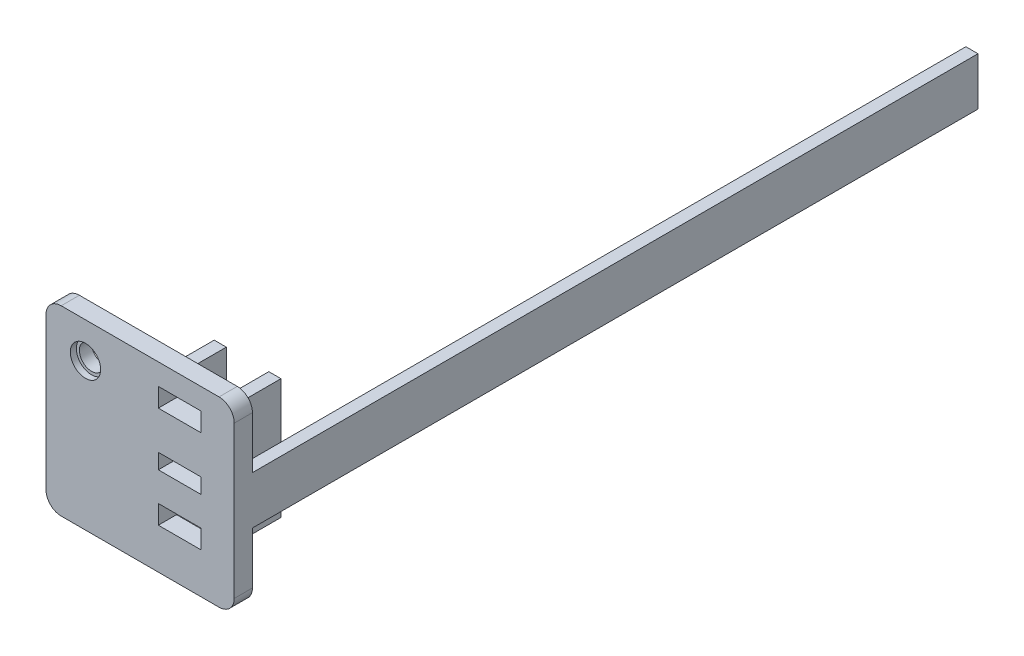
from build123d import *

# Parameters (mm, degrees)
CROQUIS2_W               = 30
CROQUIS2_H               = 31
CROQUIS2_W_2             = 3.1
CROQUIS2_H_2             = 7
CROQUIS2_W_3             = 2.5
CROQUIS2_R               = 2
SALIENTE_EXTRUIR1_DEPTH  = 3
CORTAR_EXTRUIR1_START    = 2
CROQUIS2_4_R             = 2.5
CROQUIS2_4_R_2           = 2
CORTAR_EXTRUIR1_DEPTH    = 1
CROQUIS2_5_W             = 14.15
CROQUIS2_5_H             = 10.7
SALIENTE_EXTRUIR2_DEPTH  = 2
CROQUIS2_7_W             = 7.9
CROQUIS2_7_H             = 2
SALIENTE_EXTRUIR3_DEPTH  = 119.5
CROQUIS2_9_W             = 4.8
CROQUIS2_9_H             = 7
CROQUIS2_9_W_2           = 6.3
SALIENTE_EXTRUIR4_DEPTH  = 0.6
SALIENTE_EXTRUIR5_DEPTH  = 8.2
CROQUIS3_R               = 0.95
SALIENTE_EXTRUIR6_DEPTH  = 0.4
REDONDEO1_R              = 0.25
REDONDEO1_OF_SIMETR_A1_R = 0.25
REDONDEO2_R              = 2.5


with BuildPart() as part:
    # Croquis2 → Saliente-Extruir1 (new body)
    with BuildSketch(Plane(origin=(0, 0, 0), x_dir=(0, 1, 0), z_dir=(0, 0, 1))):
        Rectangle(CROQUIS2_W, CROQUIS2_H)
        with Locations((9.95, -6.5)):
            Rectangle(CROQUIS2_W_2, CROQUIS2_H_2, mode=Mode.SUBTRACT)
        with Locations((0.85, -6.5)):
            Rectangle(CROQUIS2_W_3, CROQUIS2_H_2, mode=Mode.SUBTRACT)
        with Locations((-6.75, -6.5)):
            Rectangle(CROQUIS2_W_2, CROQUIS2_H_2, mode=Mode.SUBTRACT)
        with Locations(Location((9.15, 9, 0), (0, 0, 270))):
            Circle(CROQUIS2_R, mode=Mode.SUBTRACT)
    extrude(amount=SALIENTE_EXTRUIR1_DEPTH)

    # Croquis2<4> → Cortar-Extruir1 (cut)
    with BuildSketch(Plane(origin=(0, 0, 0), x_dir=(0, 1, 0), z_dir=(0, 0, 1)).offset(CORTAR_EXTRUIR1_START)):
        with Locations(Location((9.15, 9, 0), (0, 0, 270))):
            Circle(CROQUIS2_4_R)
        with Locations(Location((9.15, 9, 0), (0, 0, 270))):
            Circle(CROQUIS2_4_R_2, mode=Mode.SUBTRACT)
    extrude(amount=CORTAR_EXTRUIR1_DEPTH, mode=Mode.SUBTRACT)

    # Croquis2<5> → Saliente-Extruir2 (add)
    with BuildSketch(Plane(origin=(0, 0, 0), x_dir=(0, 1, 0), z_dir=(0, 0, 1))):
        with Locations((-3.775, 7.85)):
            Rectangle(CROQUIS2_5_W, CROQUIS2_5_H)
    extrude(amount=-SALIENTE_EXTRUIR2_DEPTH)

    # Croquis2<7> → Saliente-Extruir3 (add)
    with BuildSketch(Plane(origin=(0, 0, 0), x_dir=(0, 1, 0), z_dir=(0, 0, 1))):
        with Locations((0, -14.5)):
            Rectangle(CROQUIS2_7_W, CROQUIS2_7_H)
    extrude(amount=-SALIENTE_EXTRUIR3_DEPTH)

    # Croquis2<9> → Saliente-Extruir4 (add)
    with BuildSketch(Plane(origin=(0, 0, 0), x_dir=(0, 1, 0), z_dir=(0, 0, 1))):
        with Locations((-2.8, -6.5)):
            Rectangle(CROQUIS2_9_W, CROQUIS2_9_H)
        with Locations((5.25, -6.5)):
            Rectangle(CROQUIS2_9_W_2, CROQUIS2_9_H)
    extrude(amount=-SALIENTE_EXTRUIR4_DEPTH)

    # Croquis2<11> → Saliente-Extruir5 (add)
    with BuildSketch(Plane(origin=(0, 0, 0), x_dir=(0, 1, 0), z_dir=(0, 0, 1))):
        Polygon((-8.3, -3), (-8.3, -1), (11.5, -1), (11.5, -3), (8.4, -3), (2.1, -3), (-0.4, -3), (-5.2, -3), align=None)
        Polygon((11.5, -10), (11.5, -12), (-8.3, -12), (-8.3, -10), (-5.2, -10), (-0.4, -10), (2.1, -10), (8.4, -10), align=None)
    extrude(amount=-SALIENTE_EXTRUIR5_DEPTH)

    # Croquis3 → Saliente-Extruir6 (add)
    with BuildSketch(Plane.YZ.offset(3)):
        with Locations(Location((-3.1, -3.505, 0), (0, 0, 180))):
            Circle(CROQUIS3_R)
        with BuildLine():
            Line((6.769966215, -2.63), (6.030033785, -2.63))
            ThreePointArc((6.030033785, -2.63), (5.45, -3.505), (6.030033785, -4.38))
            Line((6.030033785, -4.38), (6.769966215, -4.38))
            ThreePointArc((6.769966215, -4.38), (7.35, -3.505), (6.769966215, -2.63))
        make_face()
    saliente_extruir6 = extrude(amount=SALIENTE_EXTRUIR6_DEPTH)

    # Redondeo1
    redondeo1_edges = [part.edges().sort_by_distance(p)[0] for p in [
        (3.4, -2.15, -3.505),
        (3.4, 7.35, -3.505),
        (3.4, 6.4, -2.63),
        (3.4, 5.45, -3.505),
        (3.4, 6.4, -4.38),
    ]]
    fillet(redondeo1_edges, radius=REDONDEO1_R)

    # Simetría1: Saliente-Extruir6 across plane
    add(saliente_extruir6.mirror(Plane(origin=(6.5, 0, 0), x_dir=(0, 0, 1), z_dir=(1, 0, 0))))

    # Redondeo1 of Simetría1
    redondeo1_of_simetr_a1_edges = [part.edges().sort_by_distance(p)[0] for p in [
        (9.6, -2.15, -3.505),
        (9.6, 7.35, -3.505),
        (9.6, 6.4, -2.63),
        (9.6, 5.45, -3.505),
        (9.6, 6.4, -4.38),
    ]]
    fillet(redondeo1_of_simetr_a1_edges, radius=REDONDEO1_OF_SIMETR_A1_R)

    # Redondeo2
    redondeo2_edges = [part.edges().sort_by_distance(p)[0] for p in [
        (-15.5, -15, 1.5),
        (-15.5, 15, 1.5),
        (15.5, 15, 1.5),
        (15.5, -15, 1.5),
    ]]
    fillet(redondeo2_edges, radius=REDONDEO2_R)


solid = part.part
